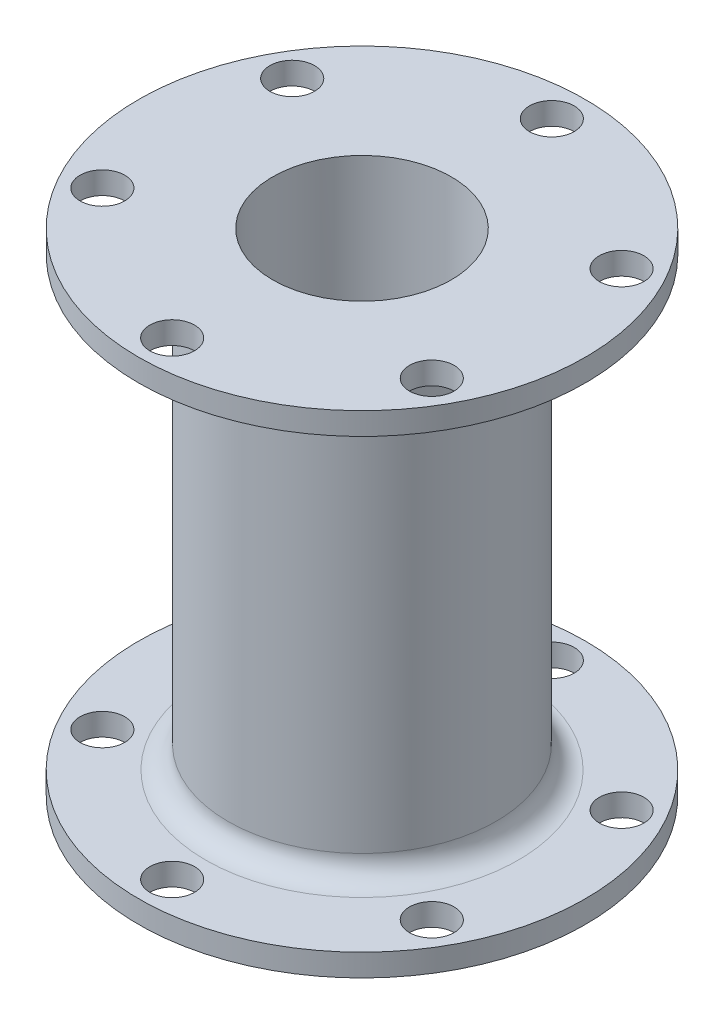
from build123d import *

# Parameters (mm, degrees)
SKETCH1_R           = 127
BOSS_EXTRUDE1_DEPTH = 12.7
SKETCH2_R           = 12.7
CUT_EXTRUDE1_DEPTH  = 12.7
SKETCH3_R           = 76.2
BOSS_EXTRUDE2_DEPTH = 254
BOSS_EXTRUDE3_START = 12.7
SKETCH4_R           = 127
BOSS_EXTRUDE3_DEPTH = 12.7
CUT_EXTRUDE2_START  = -12.7
SKETCH5_R           = 12.7
CUT_EXTRUDE2_DEPTH  = 12.7
FILLET1_R           = 12.7
SKETCH6_R           = 50.8
CUT_EXTRUDE3_DEPTH  = 1397


with BuildPart() as part:
    # Sketch1 → Boss-Extrude1 (new body)
    with BuildSketch(Plane(origin=(0, 0, 0), x_dir=(1, 0, 0), z_dir=(0, 1, 0))):
        with Locations(Location((0, 0, 0), (0, 0, 270))):
            Circle(SKETCH1_R)
    extrude(amount=BOSS_EXTRUDE1_DEPTH)

    # Sketch2 → Cut-Extrude1 (cut)
    with BuildSketch(Plane(origin=(0, 12.7, 0), x_dir=(1, 0, 0), z_dir=(0, 1, 0))):
        with Locations(Location((0, 107.95, 0), (0, 0, 270))):
            Circle(SKETCH2_R)
        with Locations(Location((0, -107.95, 0), (0, 0, 270))):
            Circle(SKETCH2_R)
        with Locations(Location((93.6625, 53.975, 0), (0, 0, 270))):
            Circle(SKETCH2_R)
        with Locations(Location((-93.6625, 53.975, 0), (0, 0, 270))):
            Circle(SKETCH2_R)
        with Locations(Location((-93.6625, -53.975, 0), (0, 0, 270))):
            Circle(SKETCH2_R)
        with Locations(Location((93.6625, -53.975, 0), (0, 0, 270))):
            Circle(SKETCH2_R)
    extrude(amount=-CUT_EXTRUDE1_DEPTH, mode=Mode.SUBTRACT)

    # Sketch3 → Boss-Extrude2 (add)
    with BuildSketch(Plane.XZ):
        with Locations(Location((0, 0, 0), (0, 0, 90))):
            Circle(SKETCH3_R)
    extrude(amount=BOSS_EXTRUDE2_DEPTH)

    # Sketch4 → Boss-Extrude3 (add)
    with BuildSketch(Plane.XZ.offset(254).offset(BOSS_EXTRUDE3_START)):
        with Locations(Location((0, 0, 0), (0, 0, 90))):
            Circle(SKETCH4_R)
    extrude(amount=-BOSS_EXTRUDE3_DEPTH)

    # Sketch5 → Cut-Extrude2 (cut)
    with BuildSketch(Plane.XZ.offset(266.7).offset(CUT_EXTRUDE2_START)):
        with Locations(Location((0, 107.95, 0), (0, 0, 90))):
            Circle(SKETCH5_R)
        with Locations(Location((0, -107.95, 0), (0, 0, 90))):
            Circle(SKETCH5_R)
        with Locations(Location((-93.6625, 53.975, 0), (0, 0, 90))):
            Circle(SKETCH5_R)
        with Locations(Location((-93.6625, -53.975, 0), (0, 0, 90))):
            Circle(SKETCH5_R)
        with Locations(Location((93.6625, 53.975, 0), (0, 0, 90))):
            Circle(SKETCH5_R)
        with Locations(Location((93.6625, -53.975, 0), (0, 0, 90))):
            Circle(SKETCH5_R)
    extrude(amount=CUT_EXTRUDE2_DEPTH, mode=Mode.SUBTRACT)

    # Fillet1
    fillet1_edges = [part.edges().sort_by_distance(p)[0] for p in [
        (0, 0, -76.2),
        (0, -254, -76.2),
    ]]
    fillet(fillet1_edges, radius=FILLET1_R)

    # Sketch6 → Cut-Extrude3 (cut)
    with BuildSketch(Plane(origin=(0, 12.7, 0), x_dir=(1, 0, 0), z_dir=(0, 1, 0))):
        with Locations(Location((0, 0, 0), (0, 0, 270))):
            Circle(SKETCH6_R)
    extrude(amount=-CUT_EXTRUDE3_DEPTH, mode=Mode.SUBTRACT)


solid = part.part
